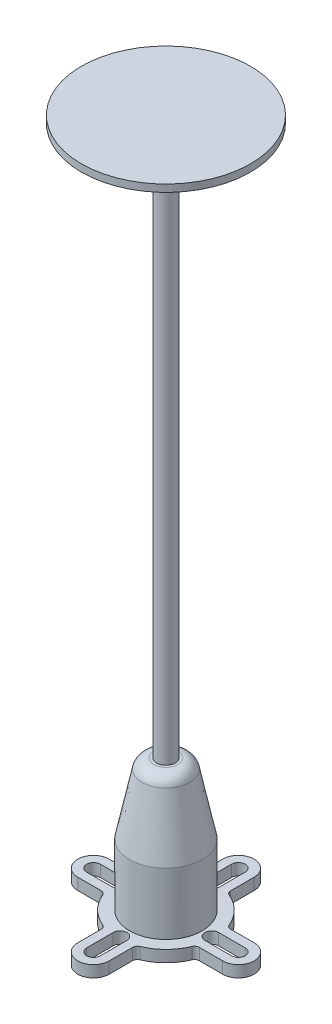
from build123d import *

# Parameters (mm, degrees)
BOSS_EXTRUDE1_DEPTH   = 2.4
FILLET1_R             = 1
SKETCH3_R             = 1.9225
BOSS_EXTRUDE2_DEPTH   = 141
KES_EKSTR_ZYON1_DEPTH = 0.06


with BuildPart() as part:
    # Sketch1 → Boss-Extrude1 (new body)
    with BuildSketch(Plane(origin=(0, 0, 0), x_dir=(1, 0, 0), z_dir=(0, 1, 0))):
        with BuildLine():
            Line((-15, 3.25), (-9.45714016, 3.25))
            ThreePointArc((-9.45714016, 3.25), (-7.071067812, 7.071067812), (-3.25, 9.45714016))
            Line((-3.25, 9.45714016), (-3.25, 15))
            ThreePointArc((-3.25, 15), (0, 18.25), (3.25, 15))
            Line((3.25, 15), (3.25, 9.45714016))
            ThreePointArc((3.25, 9.45714016), (7.071067812, 7.071067812), (9.45714016, 3.25))
            Line((9.45714016, 3.25), (15, 3.25))
            ThreePointArc((15, 3.25), (18.25, 0), (15, -3.25))
            Line((15, -3.25), (9.45714016, -3.25))
            ThreePointArc((9.45714016, -3.25), (7.071067812, -7.071067812), (3.25, -9.45714016))
            Line((3.25, -9.45714016), (3.25, -15))
            ThreePointArc((3.25, -15), (0, -18.25), (-3.25, -15))
            Line((-3.25, -15), (-3.25, -9.45714016))
            ThreePointArc((-3.25, -9.45714016), (-7.071067812, -7.071067812), (-9.45714016, -3.25))
            Line((-9.45714016, -3.25), (-15, -3.25))
            ThreePointArc((-15, -3.25), (-18.25, 0), (-15, 3.25))
        make_face()
        with BuildLine():
            Line((-15, 1.42), (-9.5, 1.42))
            ThreePointArc((-9.5, 1.42), (-8.08, 0), (-9.5, -1.42))
            Line((-9.5, -1.42), (-15, -1.42))
            ThreePointArc((-15, -1.42), (-16.42, 0), (-15, 1.42))
        make_face(mode=Mode.SUBTRACT)
        with BuildLine():
            Line((1.42, 15), (1.42, 9.5))
            ThreePointArc((1.42, 9.5), (0, 8.08), (-1.42, 9.5))
            Line((-1.42, 9.5), (-1.42, 15))
            ThreePointArc((-1.42, 15), (0, 16.42), (1.42, 15))
        make_face(mode=Mode.SUBTRACT)
        with BuildLine():
            Line((15, -1.42), (9.5, -1.42))
            ThreePointArc((9.5, -1.42), (8.08, 0), (9.5, 1.42))
            Line((9.5, 1.42), (15, 1.42))
            ThreePointArc((15, 1.42), (16.42, 0), (15, -1.42))
        make_face(mode=Mode.SUBTRACT)
        with BuildLine():
            Line((-1.42, -15), (-1.42, -9.5))
            ThreePointArc((-1.42, -9.5), (0, -8.08), (1.42, -9.5))
            Line((1.42, -9.5), (1.42, -15))
            ThreePointArc((1.42, -15), (0, -16.42), (-1.42, -15))
        make_face(mode=Mode.SUBTRACT)
    extrude(amount=BOSS_EXTRUDE1_DEPTH)

    # Fillet1
    fillet1_edges = [part.edges().sort_by_distance(p)[0] for p in [
        (-9.45714016, 1.2, -3.25),
        (-3.25, 1.2, -9.45714016),
        (3.25, 1.2, -9.45714016),
        (9.45714016, 1.2, -3.25),
        (9.45714016, 1.2, 3.25),
        (3.25, 1.2, 9.45714016),
        (-3.25, 1.2, 9.45714016),
        (-9.45714016, 1.2, 3.25),
    ]]
    fillet(fillet1_edges, radius=FILLET1_R)

    # Sketch2 → Revolve1 (revolve)
    with BuildSketch(Plane.XY, mode=Mode.PRIVATE) as revolve1_sk:
        with BuildLine():
            Line((1.925, 29.7), (2.464294328, 29.7))
            ThreePointArc((2.464294328, 29.7), (4.04285617, 29.138592921), (4.912445377, 27.70651401))
            Line((4.912445377, 27.70651401), (7.5, 15.2))
            Line((7.5, 15.2), (7.5, 2.4))
            Line((7.5, 2.4), (5.625, 2.4))
            Line((5.625, 2.4), (5.625, 15.2))
            Line((5.625, 15.2), (3.404891948, 26.194820827))
            ThreePointArc((3.404891948, 26.194820827), (2.889371485, 27.2829386), (1.925, 28.003874988))
            Line((1.925, 28.003874988), (1.925, 29.7))
        make_face()
    revolve(revolve1_sk.sketch.rotate(Axis((0, 2.4, 0), (0, 1, 0)), 90), axis=Axis((0, 2.4, 0), (0, 1, 0)))

    # Sketch3 → Boss-Extrude2 (add)
    with BuildSketch(Plane(origin=(0, 2.4, 0), x_dir=(1, 0, 0), z_dir=(0, 1, 0))):
        with Locations(Location((0, 0, 0), (0, 0, 270))):
            Circle(SKETCH3_R)
    extrude(amount=BOSS_EXTRUDE2_DEPTH)

    # Sketch4 → Revolve2 (revolve)
    with BuildSketch(Plane(origin=(0, 0, 0), x_dir=(0, 0, -1), z_dir=(1, 0, 0)), mode=Mode.PRIVATE) as revolve2_sk:
        with BuildLine():
            Line((6.922649731, 142.4), (3.230934575, 136.005761782))
            ThreePointArc((3.230934575, 136.005761782), (2.938114252, 135.712941459), (2.538114252, 135.605761782))
            Line((2.538114252, 135.605761782), (1.9225, 135.605761782))
            Line((1.9225, 135.605761782), (1.9225, 143.4))
            Line((1.9225, 143.4), (0, 143.4))
            Line((0, 143.4), (0, 144.9))
            Line((0, 144.9), (17.5, 144.9))
            Line((17.5, 144.9), (17.5, 143.4))
            Line((17.5, 143.4), (8.654700538, 143.4))
            ThreePointArc((8.654700538, 143.4), (7.654700538, 143.132050808), (6.922649731, 142.4))
        make_face()
    revolve(revolve2_sk.sketch.rotate(Axis((0, 143.4, 0), (0, -1, 0)), 180), axis=Axis((0, 143.4, 0), (0, -1, 0)))

    # Çizim1 → Kes-Ekstrüzyon1 (cut)
    # profile 1 of 3: a face of its own
    with BuildSketch(Plane.XZ.offset(-143.4)):
        Polygon((2.473531895, 11.056579199), (2.409957676, 10.172692481), (0.082320957, 10.339489356), (0.334567051, 13.859997168), (2.66220377, 13.693200293), (2.599313145, 12.809997168), (1.511715488, 12.887926856), (1.480270176, 12.451794043), (2.237008457, 12.397790137), (2.173434238, 11.513903418), (1.416695957, 11.567907324), (1.385934238, 11.134508887), align=None)
    # profile 2 of 3: a face of its own
    with BuildSketch(Plane.XZ.offset(-143.4)):
        Polygon((3.792276096, 9.57689352), (2.680752659, 10.121717739), (5.101358127, 12.856776332), (6.685244846, 12.080213832), (6.008487034, 8.490663051), (4.89764719, 9.034803676), (5.015225315, 9.640467739), (4.199014377, 10.040370082), align=None)
        Polygon((4.76639719, 10.68704977), (5.177920627, 10.485389614), (5.35702219, 11.371327114), align=None, mode=Mode.SUBTRACT)
    # profile 3 of 3: a face of its own
    with BuildSketch(Plane.XZ.offset(-143.4)):
        with BuildLine():
            Line((10.49023887, 8.045909213), (9.301469339, 7.814170932))
            add(Edge.make_bspline(
                [(9.301469339, 7.814170932), (9.295162601, 7.849093276), (9.282863589, 7.91719668), (9.259765757, 8.016165899), (9.231766875, 8.109044475), (9.199649304, 8.196046435), (9.163730366, 8.277260103), (9.122086055, 8.351638268), (9.078384744, 8.421598141), (9.044202502, 8.463454613), (9.027348245, 8.484092807)],
                knots=[0, 0, 0, 0, 1.162273231, 2.266593602, 3.326776174, 4.337490329, 5.302961409, 6.231610994, 7.128059459, 8, 8, 8, 8], degree=3))
            add(Edge.make_bspline(
                [(9.027348245, 8.484092807), (9.01594409, 8.496831925), (8.993668142, 8.52171548), (8.957180327, 8.554902215), (8.918891069, 8.58263641), (8.879448715, 8.606805989), (8.837738681, 8.624547904), (8.795060394, 8.639748228), (8.750352942, 8.648261409), (8.689312805, 8.653650441), (8.61134576, 8.649600922), (8.51970475, 8.622824869), (8.429383641, 8.578500593), (8.375376925, 8.535791651), (8.347172464, 8.513487338)],
                knots=[0, 0, 0, 0, 0.802390224, 1.567323689, 2.309785445, 3.019786053, 3.733404011, 4.433667008, 5.142780569, 5.862387035, 7.309094574, 8.775600498, 10.316089949, 12, 12, 12, 12], degree=3))
            add(Edge.make_bspline(
                [(8.347172464, 8.513487338), (8.32238698, 8.49082732), (8.275523945, 8.447982998), (8.221828166, 8.374475546), (8.186518469, 8.299074978), (8.171541706, 8.220584969), (8.176882746, 8.140146557), (8.201970979, 8.058369087), (8.24745169, 7.976028431), (8.288027536, 7.924336237), (8.309574808, 7.896885776)],
                knots=[0, 0, 0, 0, 1.136754176, 2.149312503, 3.065887517, 3.938974505, 4.829403005, 5.77323613, 6.817506254, 8, 8, 8, 8], degree=3))
            Line((8.309574808, 7.896885776), (8.728617776, 8.253038119))
            Line((8.728617776, 8.253038119), (9.527055276, 7.314463901))
            Line((9.527055276, 7.314463901), (8.085356058, 6.088096713))
            add(Edge.make_bspline(
                [(8.085356058, 6.088096713), (8.043412666, 6.130918963), (7.963019255, 6.212996893), (7.848036495, 6.330909372), (7.745125301, 6.439426088), (7.651824198, 6.535975119), (7.570495488, 6.623033205), (7.499975002, 6.699500807), (7.440576701, 6.765659164), (7.404913451, 6.806519435), (7.388774026, 6.825010776)],
                knots=[0, 0, 0, 0, 1.418494234, 2.718845215, 3.897344758, 4.957587852, 5.896065999, 6.716565202, 7.419180808, 8, 8, 8, 8], degree=3))
            add(Edge.make_bspline(
                [(7.388774026, 6.825010776), (7.362058603, 6.85691328), (7.309444418, 6.919743064), (7.236989178, 7.015916122), (7.169853497, 7.110629262), (7.110069184, 7.204873936), (7.055748887, 7.297651818), (7.008392801, 7.389665379), (6.967289467, 7.480685486), (6.932054654, 7.570889978), (6.904285219, 7.660554079), (6.881879716, 7.748984602), (6.867047818, 7.836567991), (6.8580281, 7.923104859), (6.855033423, 8.008796842), (6.859351934, 8.093567562), (6.869528685, 8.177437845), (6.89179563, 8.287308778), (6.930587621, 8.421570582), (6.989518301, 8.577515834), (7.059974362, 8.728287923), (7.144056677, 8.87248116), (7.238974286, 9.012055008), (7.347673596, 9.144627972), (7.468154157, 9.271895089), (7.556552427, 9.35016865), (7.601371683, 9.389854526)],
                knots=[0, 0, 0, 0, 1.019430757, 2.007698618, 2.949498229, 3.863326564, 4.741475116, 5.583005815, 6.397657773, 7.187755363, 7.954159737, 8.696240709, 9.42138807, 10.128624032, 10.826899417, 11.520044225, 12.206341597, 12.895087447, 14.264828925, 15.625379128, 16.976617865, 18.337454445, 19.711116215, 21.108068722, 22.533747232, 24, 24, 24, 24], degree=3))
            add(Edge.make_bspline(
                [(7.601371683, 9.389854526), (7.633267182, 9.416124727), (7.696616127, 9.468301038), (7.794804449, 9.540632275), (7.89522225, 9.606383047), (7.996644151, 9.666761034), (8.100532816, 9.720065252), (8.205586837, 9.768027651), (8.312583613, 9.809888085), (8.420955565, 9.84541849), (8.529824651, 9.873991879), (8.63797322, 9.895680951), (8.744963509, 9.908130177), (8.850675885, 9.915266481), (8.955311133, 9.911662891), (9.058901226, 9.902751782), (9.161192476, 9.884483788), (9.262208706, 9.859340021), (9.361575353, 9.826665303), (9.457961526, 9.785512166), (9.551318063, 9.73663609), (9.641991537, 9.680468107), (9.72947251, 9.615894492), (9.814300197, 9.543841789), (9.89671096, 9.464752006), (9.947642677, 9.406869871), (9.973441995, 9.377549838)],
                knots=[0, 0, 0, 0, 1.115106956, 2.214759127, 3.289362158, 4.35358504, 5.398802414, 6.439141458, 7.469269121, 8.498074177, 9.515400366, 10.505616086, 11.472095338, 12.420801102, 13.362062469, 14.294685265, 15.224871632, 16.163074203, 17.102404858, 18.044790647, 18.988299518, 19.943976261, 20.920635303, 21.91990018, 22.9463313, 24, 24, 24, 24], degree=3))
            add(Edge.make_bspline(
                [(9.973441995, 9.377549838), (10.008964061, 9.333535211), (10.080876677, 9.244429836), (10.173686342, 9.096785456), (10.258402353, 8.938194374), (10.331918381, 8.768701017), (10.393760496, 8.59235643), (10.441989787, 8.412398366), (10.475629511, 8.230183983), (10.485369339, 8.107330913), (10.49023887, 8.045909213)],
                knots=[0, 0, 0, 0, 0.93431009, 1.891463284, 2.877280637, 3.90461989, 4.942266325, 5.963808965, 6.981984622, 8, 8, 8, 8], degree=3))
        make_face()
    extrude(amount=-KES_EKSTR_ZYON1_DEPTH, mode=Mode.SUBTRACT)


solid = part.part
